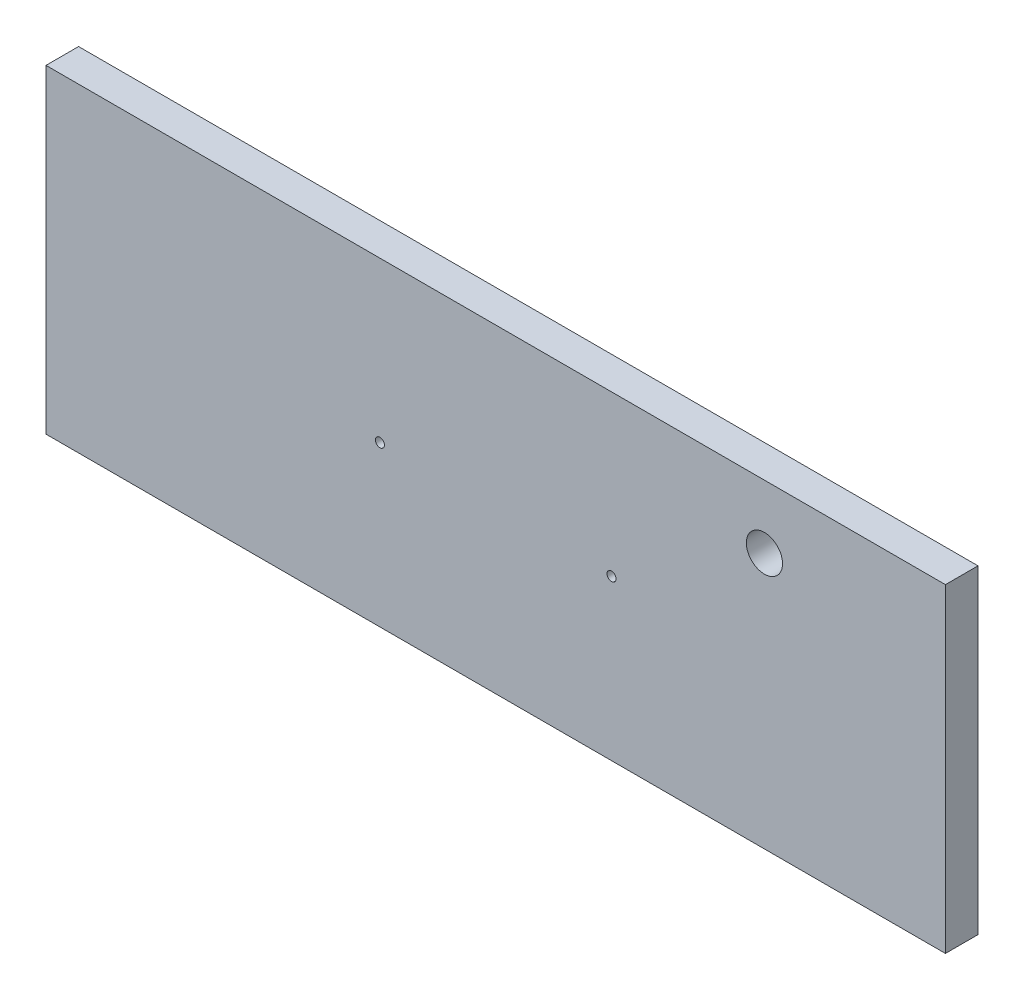
from build123d import *

# Parameters (mm, degrees)
SKETCH1_W           = 497
SKETCH1_H           = 176.5
BOSS_EXTRUDE1_DEPTH = 18
SKETCH4_R           = 2.5
CUT_EXTRUDE3_DEPTH  = 18
SKETCH5_R           = 10
CUT_EXTRUDE4_DEPTH  = 18


with BuildPart() as part:
    # Sketch1 → Boss-Extrude1 (new body)
    with BuildSketch(Plane.XY):
        with Locations((0, -123.25)):
            Rectangle(SKETCH1_W, SKETCH1_H)
    extrude(amount=BOSS_EXTRUDE1_DEPTH)

    # Sketch4 → Cut-Extrude3 (cut)
    with BuildSketch(Plane.XY.offset(18)):
        with Locations((64, -123.25)):
            Circle(SKETCH4_R)
        with Locations(Location((-64, -123.25, 0), (0, 0, 180))):
            Circle(SKETCH4_R)
    extrude(amount=-CUT_EXTRUDE3_DEPTH, mode=Mode.SUBTRACT)

    # Sketch5 → Cut-Extrude4 (cut)
    with BuildSketch(Plane.XY.offset(18)):
        with Locations((148.5, -70)):
            Circle(SKETCH5_R)
    extrude(amount=-CUT_EXTRUDE4_DEPTH, mode=Mode.SUBTRACT)


solid = part.part
